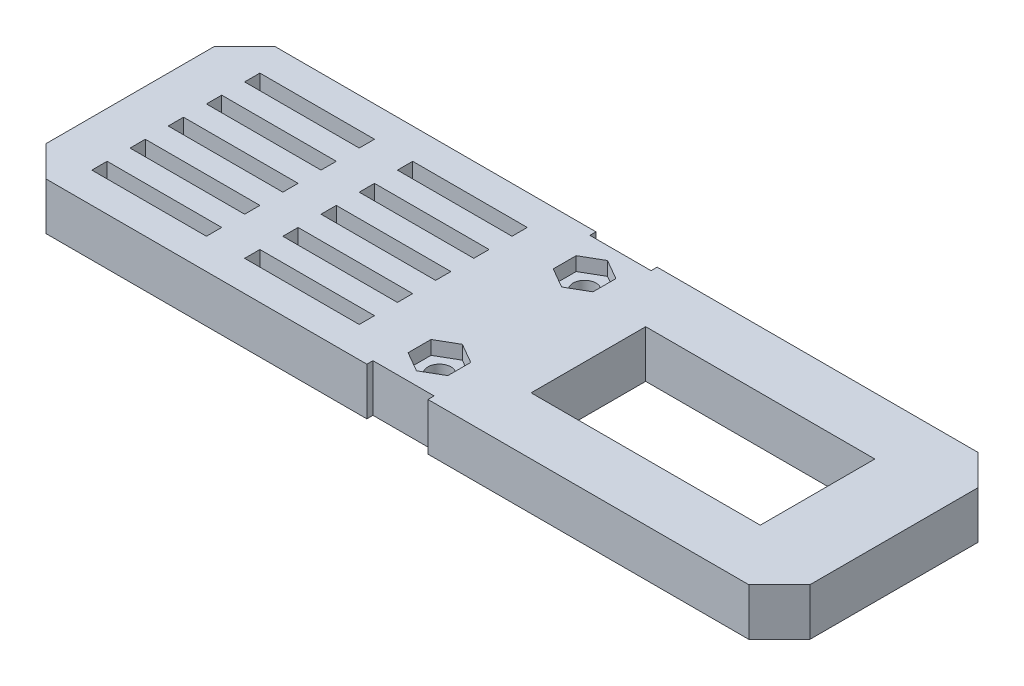
from build123d import *

# Parameters (mm, degrees)
SKETCH_1_W          = 100
SKETCH_1_H          = 30
SKETCH_1_R          = 1.5
SKETCH_1_W_2        = 15
SKETCH_1_H_2        = 2
SKETCH_1_W_3        = 30
SKETCH_1_H_3        = 15
EXTRUDE_1_DEPTH     = 3.2
CUT_EXTRUDE_START   = 3.2
CUT_EXTRUDE_1_DEPTH = 1.8
CHAMFER_1_SIZE      = 4
SKETCH_2_W          = 8
SKETCH_2_H          = 0.8
CUT_EXTRUDE_2_DEPTH = 53.299521986
EXTRUDE_START       = 3
SKETCH_3_R          = 2.75
SKETCH_3_W          = 30
SKETCH_3_H          = 15
SKETCH_3_W_2        = 15
SKETCH_3_H_2        = 2
SKETCH_3_R_2        = 1.5
EXTRUDE_2_DEPTH     = 3


with BuildPart() as part:
    # 스케치1 → 보스-돌출1 (new body)
    with BuildSketch(Plane(origin=(0, 0, 0), x_dir=(1, 0, 0), z_dir=(0, 1, 0))):
        Rectangle(SKETCH_1_W, SKETCH_1_H)
        with Locations(Location((0, 9.5, 0), (0, 0, 270))):
            Circle(SKETCH_1_R, mode=Mode.SUBTRACT)
        with Locations(Location((0, -9.5, 0), (0, 0, 270))):
            Circle(SKETCH_1_R, mode=Mode.SUBTRACT)
        with Locations((-16.5, 10)):
            Rectangle(SKETCH_1_W_2, SKETCH_1_H_2, mode=Mode.SUBTRACT)
        with Locations((25, 0)):
            Rectangle(SKETCH_1_W_3, SKETCH_1_H_3, mode=Mode.SUBTRACT)
        with Locations((-36.5, 10)):
            Rectangle(SKETCH_1_W_2, SKETCH_1_H_2, mode=Mode.SUBTRACT)
        with Locations((-36.5, 5)):
            Rectangle(SKETCH_1_W_2, SKETCH_1_H_2, mode=Mode.SUBTRACT)
        with Locations((-16.5, 5)):
            Rectangle(SKETCH_1_W_2, SKETCH_1_H_2, mode=Mode.SUBTRACT)
        with Locations((-36.5, 0)):
            Rectangle(SKETCH_1_W_2, SKETCH_1_H_2, mode=Mode.SUBTRACT)
        with Locations((-16.5, 0)):
            Rectangle(SKETCH_1_W_2, SKETCH_1_H_2, mode=Mode.SUBTRACT)
        with Locations((-36.5, -5)):
            Rectangle(SKETCH_1_W_2, SKETCH_1_H_2, mode=Mode.SUBTRACT)
        with Locations((-16.5, -5)):
            Rectangle(SKETCH_1_W_2, SKETCH_1_H_2, mode=Mode.SUBTRACT)
        with Locations((-36.5, -10)):
            Rectangle(SKETCH_1_W_2, SKETCH_1_H_2, mode=Mode.SUBTRACT)
        with Locations((-16.5, -10)):
            Rectangle(SKETCH_1_W_2, SKETCH_1_H_2, mode=Mode.SUBTRACT)
    extrude(amount=EXTRUDE_1_DEPTH)

    # 스케치1<3> → 컷-돌출1 (cut)
    with BuildSketch(Plane(origin=(0, 0, 0), x_dir=(1, 0, 0), z_dir=(0, 1, 0)).offset(CUT_EXTRUDE_START)):
        Polygon((0, 6.4977786), (2.6, 7.9988893), (2.6, 11.0011107), (0, 12.5022214), (-2.6, 11.0011107), (-2.6, 7.9988893), align=None)
        Polygon((2.6, -7.9988893), (0, -6.4977786), (-2.6, -7.9988893), (-2.6, -11.0011107), (0, -12.5022214), (2.6, -11.0011107), align=None)
    extrude(amount=-CUT_EXTRUDE_1_DEPTH, mode=Mode.SUBTRACT)

    # 모따기1
    chamfer_1_edges = [part.edges().sort_by_distance(p)[0] for p in [
        (-50, 1.6, 15),
        (-50, 1.6, -15),
        (50, 1.6, -15),
        (50, 1.6, 15),
    ]]
    chamfer(chamfer_1_edges, length=CHAMFER_1_SIZE)

    # 스케치2 → 컷-돌출2 (cut, through all)
    with BuildSketch(Plane(origin=(0, 3.2, 0), x_dir=(1, 0, 0), z_dir=(0, 1, 0))):
        with Locations((0, 14.6)):
            Rectangle(SKETCH_2_W, SKETCH_2_H)
        with Locations((0, -14.6)):
            Rectangle(SKETCH_2_W, SKETCH_2_H)
    extrude(amount=-CUT_EXTRUDE_2_DEPTH, mode=Mode.SUBTRACT)

    # 스케치3 → 보스-돌출2 (add)
    # profile 1 of 3: a face of its own
    with BuildSketch(Plane.XZ.offset(EXTRUDE_START)):
        Polygon((4, 14.2), (-4, 14.2), (-4, 15), (-46, 15), (-50, 11), (-50, -11), (-46, -15), (-4, -15), (-4, -14.2), (4, -14.2), (4, -15), (46, -15), (50, -11), (50, 11), (46, 15), (4, 15), align=None)
        with Locations(Location((0, 9.5, 0), (0, 0, 270))):
            Circle(SKETCH_3_R, mode=Mode.SUBTRACT)
        with Locations(Location((0, -9.5, 0), (0, 0, 270))):
            Circle(SKETCH_3_R, mode=Mode.SUBTRACT)
        with Locations((25, 0)):
            Rectangle(SKETCH_3_W, SKETCH_3_H, mode=Mode.SUBTRACT)
        with Locations((-36.5, 10)):
            Rectangle(SKETCH_3_W_2, SKETCH_3_H_2, mode=Mode.SUBTRACT)
        with Locations((-36.5, 5)):
            Rectangle(SKETCH_3_W_2, SKETCH_3_H_2, mode=Mode.SUBTRACT)
        with Locations((-36.5, 0)):
            Rectangle(SKETCH_3_W_2, SKETCH_3_H_2, mode=Mode.SUBTRACT)
        with Locations((-36.5, -5)):
            Rectangle(SKETCH_3_W_2, SKETCH_3_H_2, mode=Mode.SUBTRACT)
        with Locations((-36.5, -10)):
            Rectangle(SKETCH_3_W_2, SKETCH_3_H_2, mode=Mode.SUBTRACT)
        with Locations((-16.5, -10)):
            Rectangle(SKETCH_3_W_2, SKETCH_3_H_2, mode=Mode.SUBTRACT)
        with Locations((-16.5, -5)):
            Rectangle(SKETCH_3_W_2, SKETCH_3_H_2, mode=Mode.SUBTRACT)
        with Locations((-16.5, 0)):
            Rectangle(SKETCH_3_W_2, SKETCH_3_H_2, mode=Mode.SUBTRACT)
        with Locations((-16.5, 5)):
            Rectangle(SKETCH_3_W_2, SKETCH_3_H_2, mode=Mode.SUBTRACT)
        with Locations((-16.5, 10)):
            Rectangle(SKETCH_3_W_2, SKETCH_3_H_2, mode=Mode.SUBTRACT)
    # profile 2 of 3: a face of its own
    with BuildSketch(Plane.XZ.offset(EXTRUDE_START)):
        with Locations(Location((0, -9.5, 0), (0, 0, 270))):
            Circle(SKETCH_3_R_2)
    # profile 3 of 3: a face of its own
    with BuildSketch(Plane.XZ.offset(EXTRUDE_START)):
        with Locations(Location((0, 9.5, 0), (0, 0, 270))):
            Circle(SKETCH_3_R_2)
    extrude(amount=-EXTRUDE_2_DEPTH)


with BuildPart() as extrude_2_kept_piece:
    # of the separate pieces the step leaves, the one the design keeps (extrude_2_pieces_kept)
    add(part.part.solids().sort_by_distance((-4, -3, 15))[0])


solid = extrude_2_kept_piece.part
